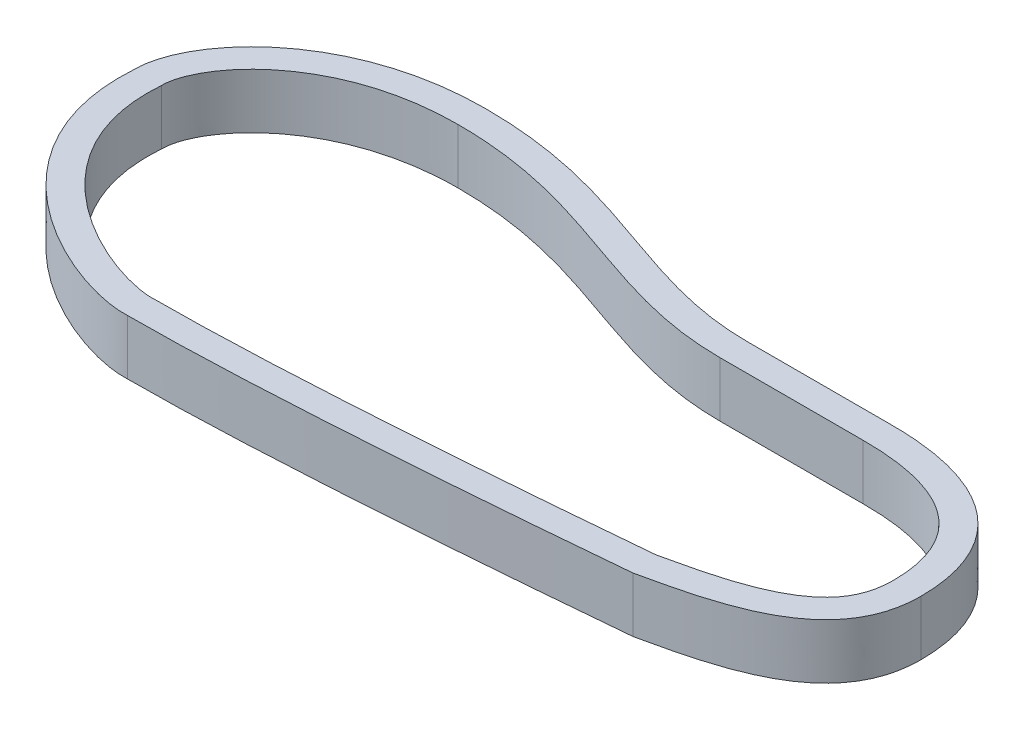
from build123d import *

# Parameters (mm, degrees)
BOSS_EXTRUDE1_DEPTH = 10
CUT_EXTRUDE2_DEPTH  = 131.512395512


with BuildPart() as part:
    # Sketch2 → Boss-Extrude1 (new body)
    with BuildSketch(Plane(origin=(0, 0, 0), x_dir=(1, 0, 0), z_dir=(0, 1, 0))):
        with BuildLine():
            Line((-26, 24.3), (0, 24.3))
            add(Edge.make_bspline(
                [(0, 24.3), (20.683832289, 24.384713811), (29.8, 14.098961604), (29.8, 0)],
                knots=[0, 0, 0, 0, 1, 1, 1, 1], degree=3))
            add(Edge.make_bspline(
                [(29.8, 0), (29.8, -15.903385672), (12.793782652, -19.673675204), (0, -22.5)],
                knots=[0, 0, 0, 0, 1, 1, 1, 1], degree=3))
            add(Edge.make_bspline(
                [(-86.5, -27.9), (-58.742591927, -27.9), (0, -22.5)],
                knots=[0, 0, 0, 1, 1, 1], degree=2))
            add(Edge.make_bspline(
                [(-124.6, 11.6), (-126.645501882, -15.929564791), (-96.169164371, -28.458925346), (-86.5, -27.9)],
                knots=[0, 0, 0, 0, 1, 1, 1, 1], degree=3))
            add(Edge.make_bspline(
                [(-86.5, 37.2), (-111.583343569, 37.2), (-124.6, 21.145918181), (-124.6, 11.6)],
                knots=[0, 0, 0, 0, 1, 1, 1, 1], degree=3))
            add(Edge.make_bspline(
                [(-26, 24.3), (-46.37360759, 24.3), (-60.223367409, 37.2), (-86.5, 37.2)],
                knots=[0, 0, 0, 0, 1, 1, 1, 1], degree=3))
        make_face()
    extrude(amount=BOSS_EXTRUDE1_DEPTH)

    # Sketch5 → Cut-Extrude2 (cut, through all)
    with BuildSketch(Plane(origin=(0, 10, 0), x_dir=(1, 0, 0), z_dir=(0, 1, 0))):
        with BuildLine():
            Line((0, 19.3), (-26, 19.3))
            add(Edge.make_bspline(
                [(-26, 19.3), (-28.614389566, 19.3), (-31.195480065, 19.494126305), (-36.299918034, 20.219008193), (-38.823236595, 20.749932309), (-43.82844627, 22.053293526), (-46.31311575, 22.826190042), (-51.244397222, 24.470393512), (-53.69402913, 25.341112046), (-58.607069123, 27.040712597), (-61.070722849, 27.868848632), (-64.806301572, 28.989279687), (-66.059451522, 29.343006622), (-68.572193461, 29.996166113), (-69.832412317, 30.295833479), (-73.626302931, 31.102275727), (-76.173387066, 31.51524352), (-81.307214737, 32.063798503), (-83.893870441, 32.2), (-86.5, 32.2)],
                knots=[0, 0, 0, 0, 0.125, 0.125, 0.25, 0.25, 0.375, 0.375, 0.5, 0.5, 0.625, 0.625, 0.6875, 0.6875, 0.75, 0.75, 0.875, 0.875, 1, 1, 1, 1], degree=3))
            add(Edge.make_bspline(
                [(-86.5, 32.2), (-90.047671723, 32.2), (-93.539315109, 31.853363621), (-97.818101716, 30.88944061), (-98.669522164, 30.669824618), (-100.363040922, 30.17291839), (-101.207876089, 29.89460231), (-103.707194596, 28.9730152), (-105.314538731, 28.24898707), (-108.402461221, 26.564840966), (-109.885156962, 25.604040465), (-112.695415045, 23.412360835), (-113.989352092, 22.209304545), (-115.736354807, 20.217749989), (-116.286105675, 19.522480074), (-117.307591473, 18.056713662), (-117.771937921, 17.297113036), (-118.380597746, 16.112260348), (-118.568848857, 15.709499136), (-118.910400222, 14.885324985), (-119.063856456, 14.46298862), (-119.32099023, 13.612441675), (-119.425833719, 13.182501201), (-119.534502641, 12.528030347), (-119.56255262, 12.308265558), (-119.588853411, 11.975515189), (-119.594973106, 11.86407762), (-119.600932982, 11.639967141), (-119.6, 11.527142129), (-119.6, 11.414500659)],
                knots=[0, 0, 0, 0, 0.25, 0.25, 0.3125, 0.3125, 0.375, 0.375, 0.5, 0.5, 0.625, 0.625, 0.75, 0.75, 0.8125, 0.8125, 0.875, 0.875, 0.90625, 0.90625, 0.9375, 0.9375, 0.96875, 0.96875, 0.984375, 0.984375, 0.9921875, 0.9921875, 1, 1, 1, 1], degree=3))
            add(Edge.make_bspline(
                [(-119.6, 11.414500659), (-119.620469876, 11.139005048), (-119.640012507, 10.863585734), (-119.66949801, 10.313536999), (-119.702590259, 9.489380197), (-119.701746238, 8.668015761), (-119.653311171, 7.029133356), (-119.558725583, 5.941670929), (-119.316814989, 4.318708201), (-119.219497862, 3.779093122), (-118.990298597, 2.702707063), (-118.857842254, 2.164001324), (-118.411370332, 0.568296748), (-118.049576648, -0.466050211), (-117.204822005, -2.479103419), (-116.721870667, -3.457814087), (-115.911016092, -4.886192051), (-115.626316263, -5.355698602), (-115.028686616, -6.281748331), (-114.715117794, -6.739029825), (-113.098128241, -8.967198862), (-111.636582687, -10.586754888), (-109.243370012, -12.821144966), (-108.411754958, -13.533067597), (-107.116844881, -14.554870601), (-106.676456633, -14.888333255), (-105.787025552, -15.535321816), (-105.337421344, -15.84934205), (-103.066112758, -17.374312871), (-101.175798147, -18.452299517), (-98.237583629, -19.870168351), (-97.240844592, -20.309198302), (-95.209999189, -21.114841784), (-94.174615133, -21.48224539), (-92.064314636, -22.126795927), (-91.001033475, -22.402007075), (-89.387886633, -22.70933152), (-88.84713932, -22.794224632), (-88.028751145, -22.879499568), (-87.754740398, -22.90089357), (-87.340882626, -22.916536257), (-87.202453029, -22.918989427), (-86.924204685, -22.915854968), (-86.784006393, -22.908070411), (-86.64375233, -22.899963035)],
                knots=[0, 0, 0, 0, 0.015625, 0.015625, 0.03125, 0.0625, 0.0625, 0.125, 0.125, 0.15625, 0.15625, 0.1875, 0.1875, 0.25, 0.25, 0.3125, 0.3125, 0.34375, 0.34375, 0.375, 0.375, 0.5, 0.5, 0.5625, 0.5625, 0.59375, 0.59375, 0.625, 0.625, 0.75, 0.75, 0.8125, 0.8125, 0.875, 0.875, 0.9375, 0.9375, 0.96875, 0.96875, 0.984375, 0.984375, 0.9921875, 0.9921875, 1, 1, 1, 1], degree=3))
            add(Edge.make_bspline(
                [(-86.64375233, -22.899963035), (-83.051721737, -22.901813131), (-79.463866007, -22.836654879), (-72.292852573, -22.630933055), (-68.709770334, -22.489158228), (-57.965349536, -21.986375675), (-50.808741052, -21.549448214), (-36.50252062, -20.563295893), (-29.353030187, -20.012120654), (-15.058799553, -18.833526914), (-7.914092044, -18.205583695), (-0.771119947, -17.549786375)],
                knots=[0, 0, 0, 0, 0.125, 0.125, 0.25, 0.25, 0.5, 0.5, 0.75, 0.75, 1, 1, 1, 1], degree=3))
            add(Edge.make_bspline(
                [(-0.771119947, -17.549786375), (1.963321139, -16.94544861), (4.695341149, -16.33357579), (8.730024902, -15.218615637), (10.064478195, -14.814466089), (12.699729823, -13.90142355), (14.000796007, -13.393364173), (15.911888282, -12.505206219), (16.542091865, -12.187905528), (17.784402153, -11.496981701), (18.391917697, -11.125662576), (19.559410174, -10.32463286), (20.121164342, -9.894098151), (20.920538613, -9.18924898), (21.180682911, -8.943393186), (21.678462153, -8.434660622), (21.916135354, -8.171907904), (22.59259098, -7.356311131), (22.994745994, -6.776081028), (23.513123046, -5.842290056), (23.671822244, -5.519779327), (23.953566298, -4.86813842), (24.077688222, -4.537273262), (24.402854637, -3.53046254), (24.556745878, -2.840315617), (24.755950633, -1.42732092), (24.8, -0.714331591), (24.8, 0)],
                knots=[0, 0, 0, 0, 0.25, 0.25, 0.375, 0.375, 0.5, 0.5, 0.5625, 0.5625, 0.625, 0.625, 0.6875, 0.6875, 0.71875, 0.71875, 0.75, 0.75, 0.8125, 0.8125, 0.84375, 0.84375, 0.875, 0.875, 0.9375, 0.9375, 1, 1, 1, 1], degree=3))
            add(Edge.make_bspline(
                [(24.8, 0), (24.800001574, 1.499794527), (24.679867583, 2.978315628), (24.270262238, 5.1554747), (24.095205029, 5.874372955), (23.764785291, 6.940708409), (23.64330548, 7.294145508), (23.375491288, 7.996618496), (23.229208001, 8.345127218), (22.758435322, 9.365838107), (22.399931747, 10.019031745), (21.589242675, 11.268187742), (21.136243882, 11.865038785), (19.63468306, 13.559968632), (18.489202915, 14.513686307), (16.909680401, 15.525653475), (16.58535259, 15.719500417), (15.929822317, 16.085938782), (15.598164332, 16.258912353), (14.592578593, 16.74990385), (13.908081512, 17.040104299), (12.515293354, 17.557881638), (11.806985872, 17.785415353), (10.369782811, 18.186296846), (9.638661479, 18.360025682), (7.436633609, 18.806009812), (5.959001697, 19.004489088), (2.98950105, 19.255065786), (1.497532001, 19.3061318), (0, 19.3)],
                knots=[0, 0, 0, 0, 0.125, 0.125, 0.1875, 0.1875, 0.21875, 0.21875, 0.25, 0.25, 0.3125, 0.3125, 0.375, 0.375, 0.5, 0.5, 0.53125, 0.53125, 0.5625, 0.5625, 0.625, 0.625, 0.6875, 0.6875, 0.75, 0.75, 0.875, 0.875, 1, 1, 1, 1], degree=3))
        make_face()
    extrude(amount=-CUT_EXTRUDE2_DEPTH, mode=Mode.SUBTRACT)


solid = part.part
